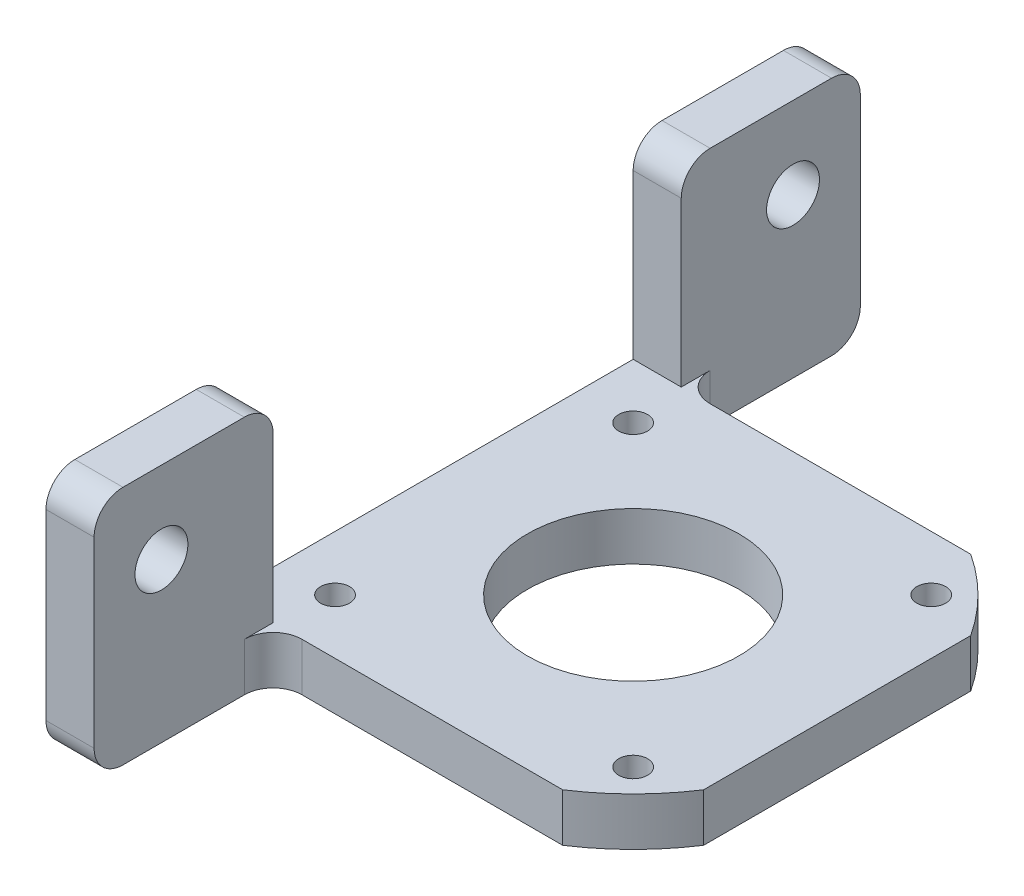
from build123d import *

# Parameters (mm, degrees)
BOSS_EXTRUDE1_DEPTH = 5
SKETCH3_R           = 1.5
SKETCH3_R_2         = 10.9982
CUT_EXTRUDE1_DEPTH  = 5
SKETCH5_W           = 5
SKETCH5_H           = 5
BOSS_EXTRUDE2_DEPTH = 18.62
SKETCH6_W           = 5
SKETCH6_H           = 18.62
BOSS_EXTRUDE3_DEPTH = 20
CUT_EXTRUDE2_REACH  = 62.095
SKETCH7_R           = 2.75
FILLET1_R           = 3


with BuildPart() as part:
    # Sketch1 → Boss-Extrude1 (new body)
    with BuildSketch(Plane(origin=(0, 0, 0), x_dir=(1, 0, 0), z_dir=(0, 1, 0))):
        with BuildLine():
            Line((-13.883812864, -21.209), (-21.209, -21.209))
            Line((-21.209, -21.209), (-21.209, -13.883812864))
            Line((-21.209, -13.883812864), (-21.209, 13.883812864))
            Line((-21.209, 13.883812864), (-21.209, 21.209))
            Line((-21.209, 21.209), (-13.883812864, 21.209))
            Line((-13.883812864, 21.209), (13.883812864, 21.209))
            ThreePointArc((13.883812864, 21.209), (17.924591218, 17.924591218), (21.209, 13.883812864))
            Line((21.209, 13.883812864), (21.209, -13.883812864))
            ThreePointArc((21.209, -13.883812864), (17.924591218, -17.924591218), (13.883812864, -21.209))
            Line((13.883812864, -21.209), (-13.883812864, -21.209))
        make_face()
    extrude(amount=BOSS_EXTRUDE1_DEPTH)

    # Sketch3 → Cut-Extrude1 (cut)
    with BuildSketch(Plane(origin=(0, 0, 0), x_dir=(1, 0, 0), z_dir=(0, 1, 0))):
        with Locations(Location((15.494, -15.494, 0), (0, 0, 270))):
            Circle(SKETCH3_R)
        with Locations(Location((15.494, 15.494, 0), (0, 0, 270))):
            Circle(SKETCH3_R)
        with Locations(Location((-15.494, -15.494, 0), (0, 0, 270))):
            Circle(SKETCH3_R)
        with Locations(Location((-15.494, 15.494, 0), (0, 0, 270))):
            Circle(SKETCH3_R)
        with Locations(Location((0, 0, 0), (0, 0, 270))):
            Circle(SKETCH3_R_2)
    extrude(amount=CUT_EXTRUDE1_DEPTH, mode=Mode.SUBTRACT)

    # Sketch5 → Boss-Extrude2 (add)
    with BuildSketch(Plane.XY.offset(21.209)):
        with Locations((-18.709, 2.5)):
            Rectangle(SKETCH5_W, SKETCH5_H)
    boss_extrude2 = extrude(amount=BOSS_EXTRUDE2_DEPTH)

    # Sketch6 → Boss-Extrude3 (add)
    with BuildSketch(Plane(origin=(0, 5, 0), x_dir=(1, 0, 0), z_dir=(0, 1, 0))):
        with Locations((-18.709, -30.519)):
            Rectangle(SKETCH6_W, SKETCH6_H)
    boss_extrude3 = extrude(amount=BOSS_EXTRUDE3_DEPTH)

    # Sketch7 → Cut-Extrude2 (cut, up to next)
    with BuildSketch(Plane(origin=(-16.209, 0, 0), x_dir=(0, 0, -1), z_dir=(1, 0, 0)), mode=Mode.PRIVATE) as cut_extrude2_sk1:
        with Locations((-32.829, 16.5)):
            Circle(SKETCH7_R)
    cut_extrude2_tool1 = extrude(cut_extrude2_sk1.sketch, amount=-CUT_EXTRUDE2_REACH, mode=Mode.PRIVATE) & part.part
    cut_extrude2 = cut_extrude2_tool1.solids().sort_by_distance((-16.209, 16.5, 32.829))[0]
    add(cut_extrude2, mode=Mode.SUBTRACT)

    # Mirror3: Boss-Extrude2, Boss-Extrude3, Cut-Extrude2 across plane
    add(boss_extrude2.mirror(Plane(origin=(0, 0, 0), x_dir=(1, 0, 0), z_dir=(0, 0, -1))))
    add(boss_extrude3.mirror(Plane(origin=(0, 0, 0), x_dir=(1, 0, 0), z_dir=(0, 0, -1))))
    add(cut_extrude2.mirror(Plane(origin=(0, 0, 0), x_dir=(1, 0, 0), z_dir=(0, 0, -1))), mode=Mode.SUBTRACT)

    # Fillet1
    fillet1_edges = [part.edges().sort_by_distance(p)[0] for p in [
        (-16.209, 2.5, 21.209),
        (-18.709, 0, 39.829),
        (-18.709, 0, -39.829),
        (-18.709, 25, 39.829),
        (-18.709, 25, -39.829),
        (-16.209, 2.5, -21.209),
        (-18.709, 25, -21.209),
        (-18.709, 25, 21.209),
    ]]
    fillet(fillet1_edges, radius=FILLET1_R)


solid = part.part
